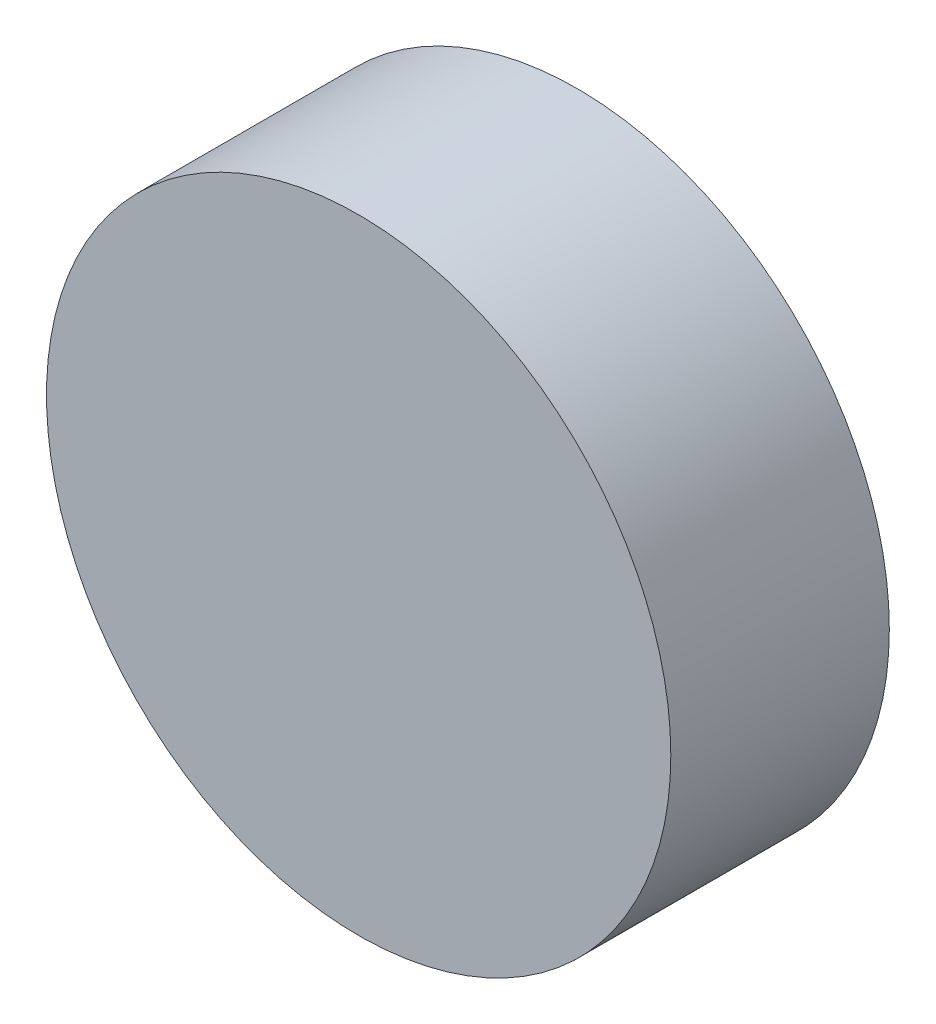
from build123d import *

# Parameters (mm, degrees)
SKETCH1_R           = 25.4
SKETCH1_R_2         = 23.876
BOSS_EXTRUDE1_DEPTH = 17.78
BOSS_EXTRUDE2_START = -2.54
SKETCH2_R           = 23.876
BOSS_EXTRUDE2_DEPTH = 2.54


with BuildPart() as part:
    # Sketch1 → Boss-Extrude1 (new body)
    with BuildSketch(Plane.XY):
        Circle(SKETCH1_R)
        Circle(SKETCH1_R_2, mode=Mode.SUBTRACT)
    extrude(amount=BOSS_EXTRUDE1_DEPTH)

    # Sketch2 → Boss-Extrude2 (add)
    with BuildSketch(Plane.XY.offset(17.78).offset(BOSS_EXTRUDE2_START)):
        Circle(SKETCH2_R)
    extrude(amount=BOSS_EXTRUDE2_DEPTH)


solid = part.part
